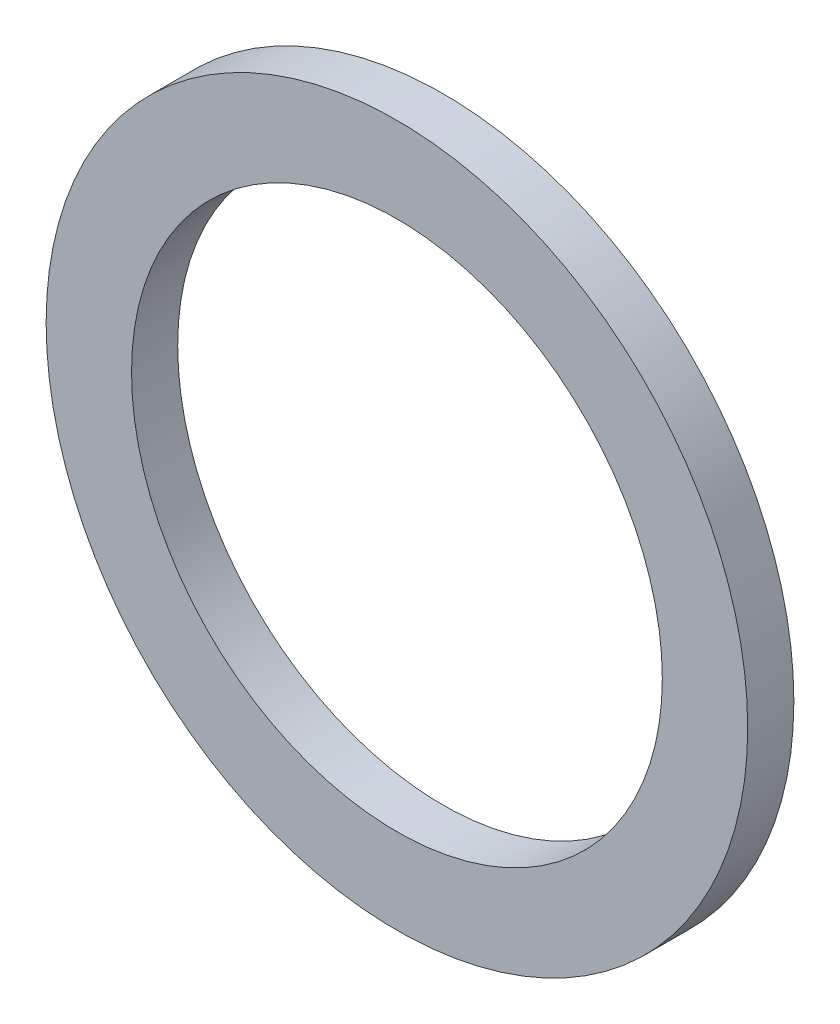
from build123d import *

# Parameters (mm, degrees)
SKETCH1_W = 1.85
SKETCH1_H = 1


with BuildPart() as part:
    # Sketch1 → REV_DIN471_12x1_envelope (revolve)
    with BuildSketch(Plane(origin=(0, 0, 0), x_dir=(1, 0, 0), z_dir=(0, 1, 0))):
        with Locations((6.675, -45.5)):
            Rectangle(SKETCH1_W, SKETCH1_H)
    revolve(axis=Axis((0, 0, 150), (0, 0, -1)))


solid = part.part
